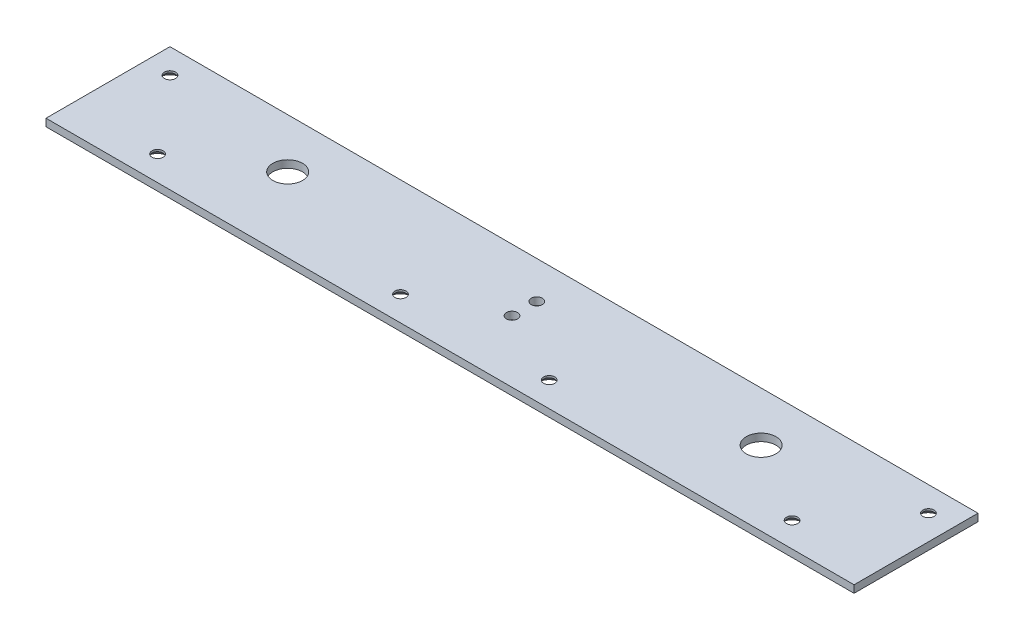
from build123d import *

# Parameters (mm, degrees)
SKIZZE1_W                            = 326
SKIZZE1_H                            = 50
AUFSATZ_LINEAR_AUSTRAGEN1_DEPTH      = 3
DURCHGANGSLOCH_F_R_M41_D             = 4.5
F_9_0_12_DURCHMESSER_BOHRUNG1_D      = 12
FORMSENKUNG_F_R_M4_SFHCS1_AT_2_COUNT = 2
FORMSENKUNG_F_R_M4_SFHCS1_AT_2_PITCH = 306
FORMSENKUNG_F_R_M4_SFHCS1_AT_3_COUNT = 2
FORMSENKUNG_F_R_M4_SFHCS1_AT_3_PITCH = 282.596886041
FORMSENKUNG_F_R_M4_SFHCS1_AT_4_COUNT = 2
FORMSENKUNG_F_R_M4_SFHCS1_AT_4_PITCH = 185.442713526
FORMSENKUNG_F_R_M4_SFHCS1_AT_5_COUNT = 2
FORMSENKUNG_F_R_M4_SFHCS1_AT_5_PITCH = 126.605687076
FORMSENKUNG_F_R_M4_SFHCS1_AT_6_COUNT = 2
FORMSENKUNG_F_R_M4_SFHCS1_AT_6_PITCH = 39.05124838


with BuildPart() as part:
    # Skizze1 → Aufsatz-Linear austragen1 (new body)
    with BuildSketch(Plane(origin=(0, 0, 0), x_dir=(1, 0, 0), z_dir=(0, 1, 0))):
        Rectangle(SKIZZE1_W, SKIZZE1_H)
    extrude(amount=AUFSATZ_LINEAR_AUSTRAGEN1_DEPTH)

    # Durchgangsloch für M41 (through all)
    with Locations(Plane(origin=(0, 3, 0), x_dir=(1, 0, 0), z_dir=(0, 1, 0))):
        with Locations((0, 0), (0, 10)):
            Hole(DURCHGANGSLOCH_F_R_M41_D / 2)

    # Ø9.0 (12) Durchmesser Bohrung1 (through all)
    with Locations(Plane(origin=(0, 3, 0), x_dir=(1, 0, 0), z_dir=(0, 1, 0))):
        with Locations((-95.5, 5), (95.5, 5)):
            Hole(F_9_0_12_DURCHMESSER_BOHRUNG1_D / 2)

    # Skizze7 → Formsenkung für M4 SFHCS1 (revolve, cut)
    with BuildSketch(Plane(origin=(153, 0, -15), x_dir=(0, 0, -1), z_dir=(1, 0, 0))):
        Polygon((0, 0), (0, 3), (2.25, 3), (2.25, 2.23), (4.48, 0), align=None)
    formsenkung_f_r_m4_sfhcs1 = revolve(axis=Axis((153, -6.35, -15), (0, 1, 0)), mode=Mode.SUBTRACT)

    # Formsenkung für M4 SFHCS1 at 2: Formsenkung für M4 SFHCS1 ×2
    with Locations(*[(-i * FORMSENKUNG_F_R_M4_SFHCS1_AT_2_PITCH, 0, 0) for i in range(1, FORMSENKUNG_F_R_M4_SFHCS1_AT_2_COUNT)]):
        add(formsenkung_f_r_m4_sfhcs1, mode=Mode.SUBTRACT)

    # Formsenkung für M4 SFHCS1 at 3: Formsenkung für M4 SFHCS1 ×2
    with Locations(*[Vector(-0.9943492440300802, 0, 0.10615828228079148) * (i * FORMSENKUNG_F_R_M4_SFHCS1_AT_3_PITCH) for i in range(1, FORMSENKUNG_F_R_M4_SFHCS1_AT_3_COUNT)]):
        add(formsenkung_f_r_m4_sfhcs1, mode=Mode.SUBTRACT)

    # Formsenkung für M4 SFHCS1 at 4: Formsenkung für M4 SFHCS1 ×2
    with Locations(*[Vector(-0.9868276651055338, 0, 0.16177502706648092) * (i * FORMSENKUNG_F_R_M4_SFHCS1_AT_4_PITCH) for i in range(1, FORMSENKUNG_F_R_M4_SFHCS1_AT_4_COUNT)]):
        add(formsenkung_f_r_m4_sfhcs1, mode=Mode.SUBTRACT)

    # Formsenkung für M4 SFHCS1 at 5: Formsenkung für M4 SFHCS1 ×2
    with Locations(*[Vector(-0.9715203387831296, 0, 0.23695618019100717) * (i * FORMSENKUNG_F_R_M4_SFHCS1_AT_5_PITCH) for i in range(1, FORMSENKUNG_F_R_M4_SFHCS1_AT_5_COUNT)]):
        add(formsenkung_f_r_m4_sfhcs1, mode=Mode.SUBTRACT)

    # Formsenkung für M4 SFHCS1 at 6: Formsenkung für M4 SFHCS1 ×2
    with Locations(*[Vector(-0.6401843996644799, 0, 0.7682212795973759) * (i * FORMSENKUNG_F_R_M4_SFHCS1_AT_6_PITCH) for i in range(1, FORMSENKUNG_F_R_M4_SFHCS1_AT_6_COUNT)]):
        add(formsenkung_f_r_m4_sfhcs1, mode=Mode.SUBTRACT)


solid = part.part
